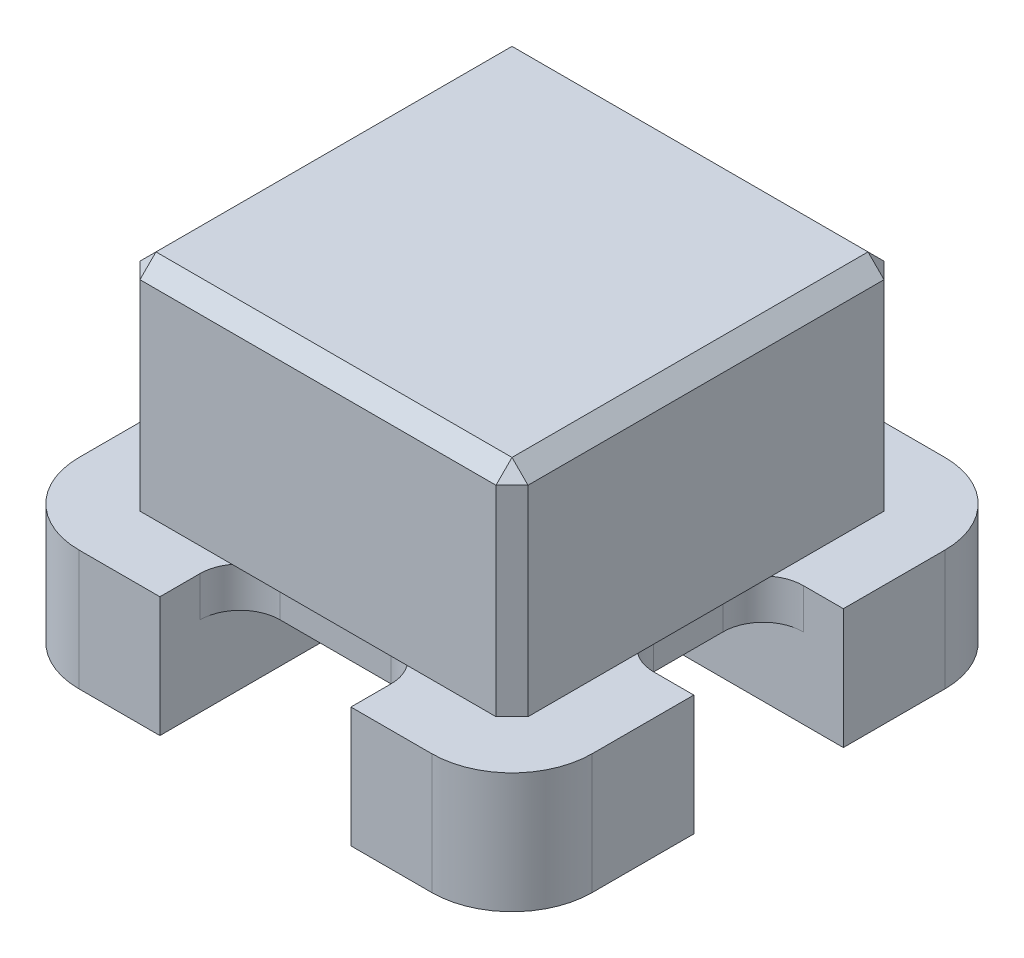
from build123d import *

# Parameters (mm, degrees)
SKETCH1_W           = 44
SKETCH1_H           = 44
SKETCH1_W_2         = 40
SKETCH1_H_2         = 40
EXTRUDE_THIN1_DEPTH = 30
SKETCH3_R           = 7.023320088
BOSS_EXTRUDE1_DEPTH = 2
BOSS_EXTRUDE2_START = -5
SKETCH4_W           = 10.088390541
SKETCH4_H           = 12.67398169
BOSS_EXTRUDE2_DEPTH = 15
EXTRUDE_THIN2_START = -24.8
SKETCH5_W           = 48.4
SKETCH5_H           = 48.4
SKETCH5_W_2         = 44.4
SKETCH5_H_2         = 44.4
EXTRUDE_THIN2_DEPTH = 25
SKETCH6_W           = 48.4
SKETCH6_H           = 48.4
BOSS_EXTRUDE3_DEPTH = 2
CHAMFER2_SIZE       = 2
FILLET1_R           = 10
FILLET2_R           = 5


with BuildPart() as part:
    # Sketch1 → Extrude-Thin1 (new body)
    with BuildSketch(Plane(origin=(0, 0, 0), x_dir=(1, 0, 0), z_dir=(0, 1, 0))):
        Rectangle(SKETCH1_W, SKETCH1_H)
        Rectangle(SKETCH1_W_2, SKETCH1_H_2, mode=Mode.SUBTRACT)
    extrude(amount=EXTRUDE_THIN1_DEPTH)

    # Sketch3 → Boss-Extrude1 (add)
    with BuildSketch(Plane.XZ):
        with BuildLine():
            Line((20, 20), (-20, 20))
            Line((-20, 20), (-20, 7.023320088))
            ThreePointArc((-20, 7.023320088), (-15.033762739, 4.966237261), (-12.976679912, 0))
            ThreePointArc((-12.976679912, 0), (-15.033762739, -4.966237261), (-20, -7.023320088))
            Line((-20, -7.023320088), (-20, -20))
            Line((-20, -20), (20, -20))
            Line((20, -20), (20, -7.023320088))
            ThreePointArc((20, -7.023320088), (12.976679912, 0), (20, 7.023320088))
            Line((20, 7.023320088), (20, 20))
        make_face()
        with Locations(Location((0, 0, 0), (0, 0, 270))):
            Circle(SKETCH3_R, mode=Mode.SUBTRACT)
    extrude(amount=-BOSS_EXTRUDE1_DEPTH)

    # Sketch4 → Boss-Extrude2 (add)
    with BuildSketch(Plane.XZ.offset(BOSS_EXTRUDE2_START)):
        Polygon((-11.911609459, 22), (-11.911609459, 32), (-32, 32), (-32, 9.32601831), (-22, 9.32601831), (-22, 22), align=None)
        Polygon((22, 9.32601831), (32, 9.32601831), (32, 32), (11.911609459, 32), (11.911609459, 22), (22, 22), align=None)
        Polygon((11.911609459, -32), (32, -32), (32, -9.32601831), (22, -9.32601831), (22, -22), (11.911609459, -22), align=None)
        with Locations((16.95580473, -15.663009155)):
            Rectangle(SKETCH4_W, SKETCH4_H)
        Polygon((-32, -32), (-11.911609459, -32), (-11.911609459, -22), (-22, -22), (-22, -9.32601831), (-32, -9.32601831), align=None)
        with Locations((-16.95580473, -15.663009155)):
            Rectangle(SKETCH4_W, SKETCH4_H)
        with Locations((-16.95580473, 15.663009155)):
            Rectangle(SKETCH4_W, SKETCH4_H)
        with Locations((16.95580473, 15.663009155)):
            Rectangle(SKETCH4_W, SKETCH4_H)
    extrude(amount=BOSS_EXTRUDE2_DEPTH)

    # Fillet1
    fillet1_edges = [part.edges().sort_by_distance(p)[0] for p in [
        (-32, -2.5, 32),
        (32, -2.5, 32),
        (32, -2.5, -32),
        (-32, -2.5, -32),
    ]]
    fillet(fillet1_edges, radius=FILLET1_R)

    # Fillet2
    fillet2_edges = [part.edges().sort_by_distance(p)[0] for p in [
        (-11.911609459, 2.5, 22),
        (-22, 2.5, 9.32601831),
        (11.911609459, 2.5, 22),
        (22, 2.5, 9.32601831),
        (22, 2.5, -9.32601831),
        (11.911609459, 2.5, -22),
        (-11.911609459, 2.5, -22),
        (-22, 2.5, -9.32601831),
    ]]
    fillet(fillet2_edges, radius=FILLET2_R)


with BuildPart() as body_2:
    # Sketch5 → Extrude-Thin2 (new body)
    with BuildSketch(Plane(origin=(0, 30, 0), x_dir=(1, 0, 0), z_dir=(0, 1, 0)).offset(EXTRUDE_THIN2_START)):
        Rectangle(SKETCH5_W, SKETCH5_H)
        Rectangle(SKETCH5_W_2, SKETCH5_H_2, mode=Mode.SUBTRACT)
    extrude(amount=EXTRUDE_THIN2_DEPTH)

    # Sketch6 → Boss-Extrude3 (add)
    with BuildSketch(Plane(origin=(0, 30.2, 0), x_dir=(1, 0, 0), z_dir=(0, 1, 0))):
        Rectangle(SKETCH6_W, SKETCH6_H)
    extrude(amount=BOSS_EXTRUDE3_DEPTH)

    # Chamfer2
    chamfer2_edges = [body_2.edges().sort_by_distance(p)[0] for p in [
        (-24.2, 18.7, -24.2),
        (24.2, 18.7, -24.2),
        (-24.2, 32.2, 0),
        (0, 32.2, 24.2),
        (24.2, 32.2, 0),
        (0, 32.2, -24.2),
        (24.2, 18.7, 24.2),
        (-24.2, 18.7, 24.2),
    ]]
    chamfer(chamfer2_edges, length=CHAMFER2_SIZE)


solid = Compound([part.part, body_2.part])
